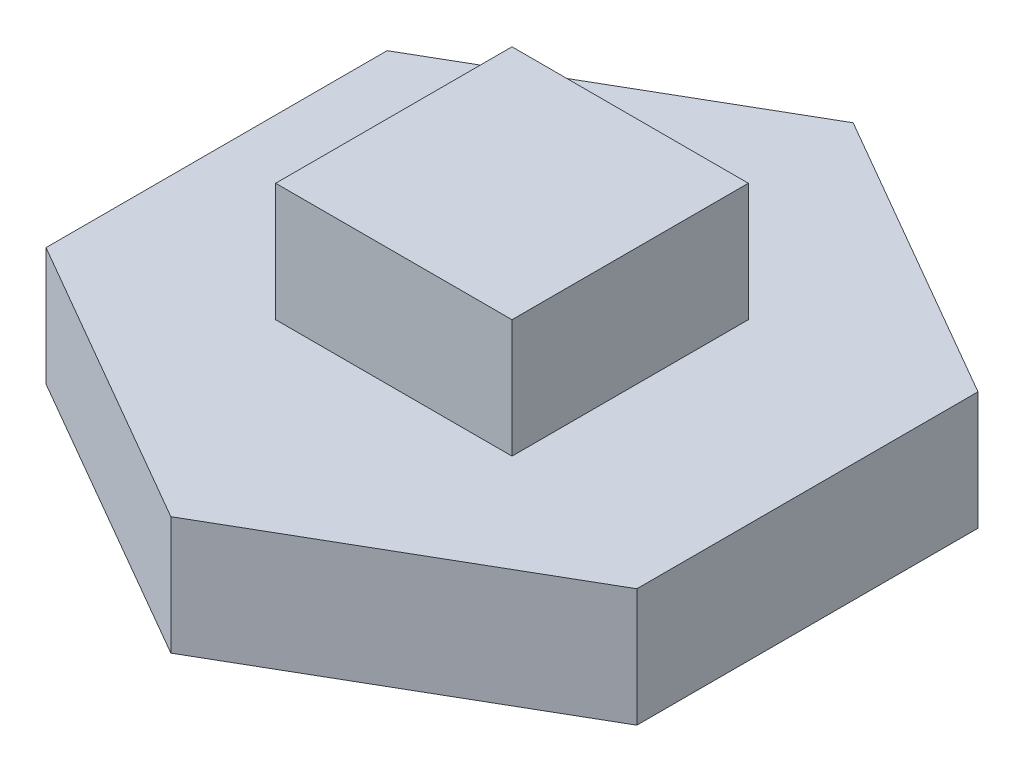
from build123d import *

# Parameters (mm, degrees)
EXTRUDE_1_DEPTH = 10
SKETCH_2_W      = 20
SKETCH_2_H      = 20
EXTRUDE_2_DEPTH = 10


with BuildPart() as part:
    # 草图1 → 凸台-拉伸1 (new body)
    with BuildSketch(Plane(origin=(0, 0, 0), x_dir=(1, 0, 0), z_dir=(0, 1, 0))):
        Polygon((25, 14.43375673), (0, 28.867513459), (-25, 14.43375673), (-25, -14.43375673), (0, -28.867513459), (25, -14.43375673), align=None)
    extrude(amount=EXTRUDE_1_DEPTH)

    # 草图2 → 凸台-拉伸2 (add)
    with BuildSketch(Plane(origin=(0, 10, 0), x_dir=(1, 0, 0), z_dir=(0, 1, 0))):
        Rectangle(SKETCH_2_W, SKETCH_2_H)
    extrude(amount=EXTRUDE_2_DEPTH)


solid = part.part
